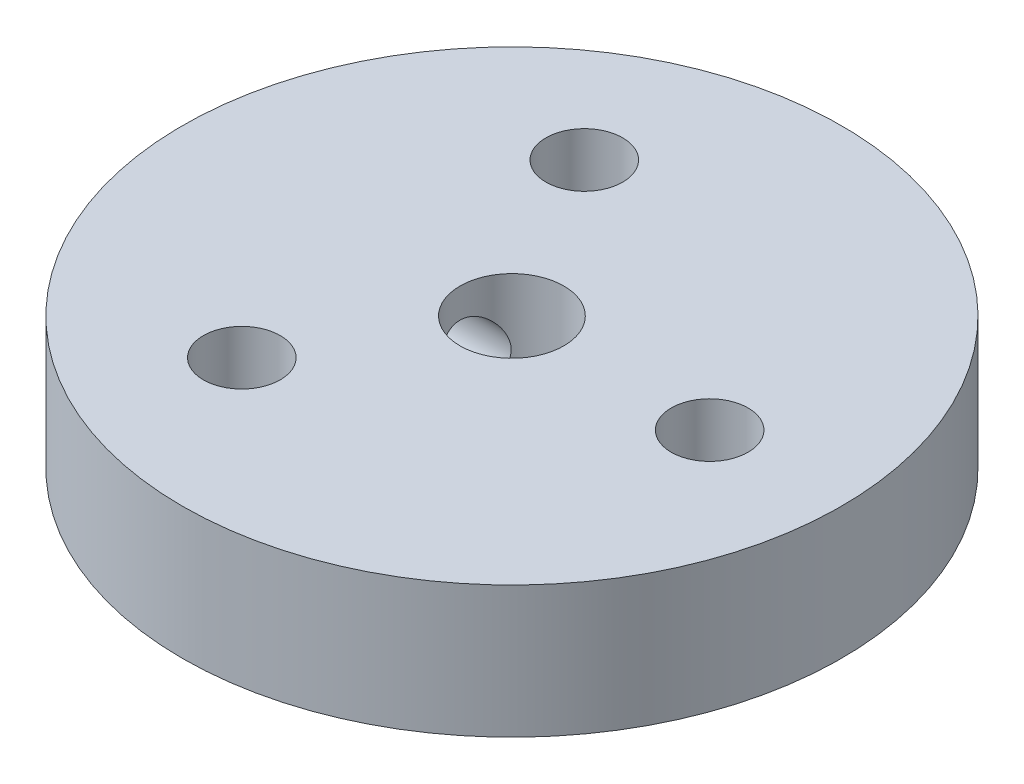
from build123d import *

# Parameters (mm, degrees)
SKETCH1_R           = 15.875
SKETCH1_R_2         = 2.499999953
SKETCH1_R_3         = 1.849999983
BOSS_EXTRUDE2_DEPTH = 3.175
SKETCH3_R           = 1.750000056
CUT_EXTRUDE1_DEPTH  = 23.674035261


with BuildPart() as part:
    # Sketch1 → Boss-Extrude2 (new, symmetric)
    with BuildSketch(Plane(origin=(0, 0, 0), x_dir=(1, 0, 0), z_dir=(0, 1, 0))):
        with Locations(Location((0, 0, 0), (0, 0, 270))):
            Circle(SKETCH1_R)
        with Locations(Location((0, 0, 0), (0, 0, 270))):
            Circle(SKETCH1_R_2, mode=Mode.SUBTRACT)
        with Locations(Location((9.525, 0, 0), (0, 0, 270))):
            Circle(SKETCH1_R_3, mode=Mode.SUBTRACT)
        with Locations(Location((-4.7625, -8.248891971, 0), (0, 0, 270))):
            Circle(SKETCH1_R_3, mode=Mode.SUBTRACT)
        with Locations(Location((-4.7625, 8.248891971, 0), (0, 0, 270))):
            Circle(SKETCH1_R_3, mode=Mode.SUBTRACT)
    extrude(amount=BOSS_EXTRUDE2_DEPTH, both=True)

    # Sketch3 → Cut-Extrude1 (cut, through all)
    with BuildSketch(Plane(origin=(0, 0, 0), x_dir=(0, 0, -1), z_dir=(1, 0, 0))):
        Circle(SKETCH3_R)
    extrude(amount=-CUT_EXTRUDE1_DEPTH, mode=Mode.SUBTRACT)


solid = part.part
